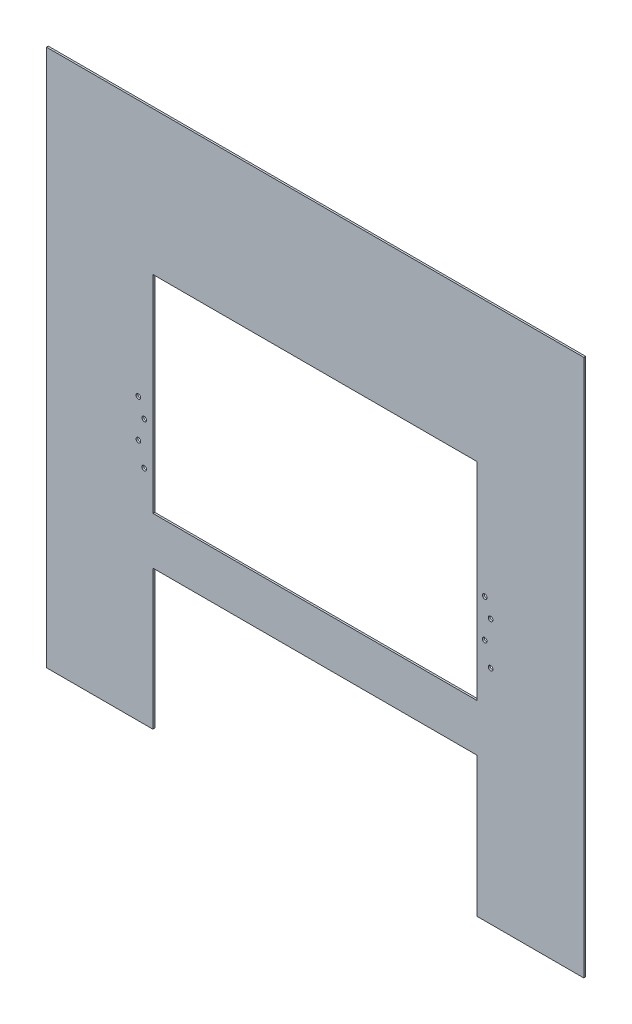
from build123d import *

# Parameters (mm, degrees)
SKETCH_1_R      = 2.5
SKETCH_1_W      = 350
SKETCH_1_H      = 223.275
EXTRUDE_1_DEPTH = 2


with BuildPart() as part:
    # 草图1 → 凸台-拉伸1 (new body)
    with BuildSketch(Plane.XY):
        Polygon((70, 580), (650, 580), (650, 0), (535, 0), (535, 150.575), (185, 150.575), (185, 0), (70, 0), align=None)
        with Locations((175.620271067, 285.3)):
            Circle(SKETCH_1_R, mode=Mode.SUBTRACT)
        with Locations((175.620271067, 239.279728933)):
            Circle(SKETCH_1_R, mode=Mode.SUBTRACT)
        with Locations((169.3, 262.3)):
            Circle(SKETCH_1_R, mode=Mode.SUBTRACT)
        with Locations((169.3, 303.1)):
            Circle(SKETCH_1_R, mode=Mode.SUBTRACT)
        with Locations((549.420271067, 285.3)):
            Circle(SKETCH_1_R, mode=Mode.SUBTRACT)
        with Locations((549.420271067, 239.279728933)):
            Circle(SKETCH_1_R, mode=Mode.SUBTRACT)
        with Locations((543.1, 262.3)):
            Circle(SKETCH_1_R, mode=Mode.SUBTRACT)
        with Locations((543.1, 303.1)):
            Circle(SKETCH_1_R, mode=Mode.SUBTRACT)
        with Locations((360, 313.3625)):
            Rectangle(SKETCH_1_W, SKETCH_1_H, mode=Mode.SUBTRACT)
    extrude(amount=EXTRUDE_1_DEPTH)


solid = part.part
